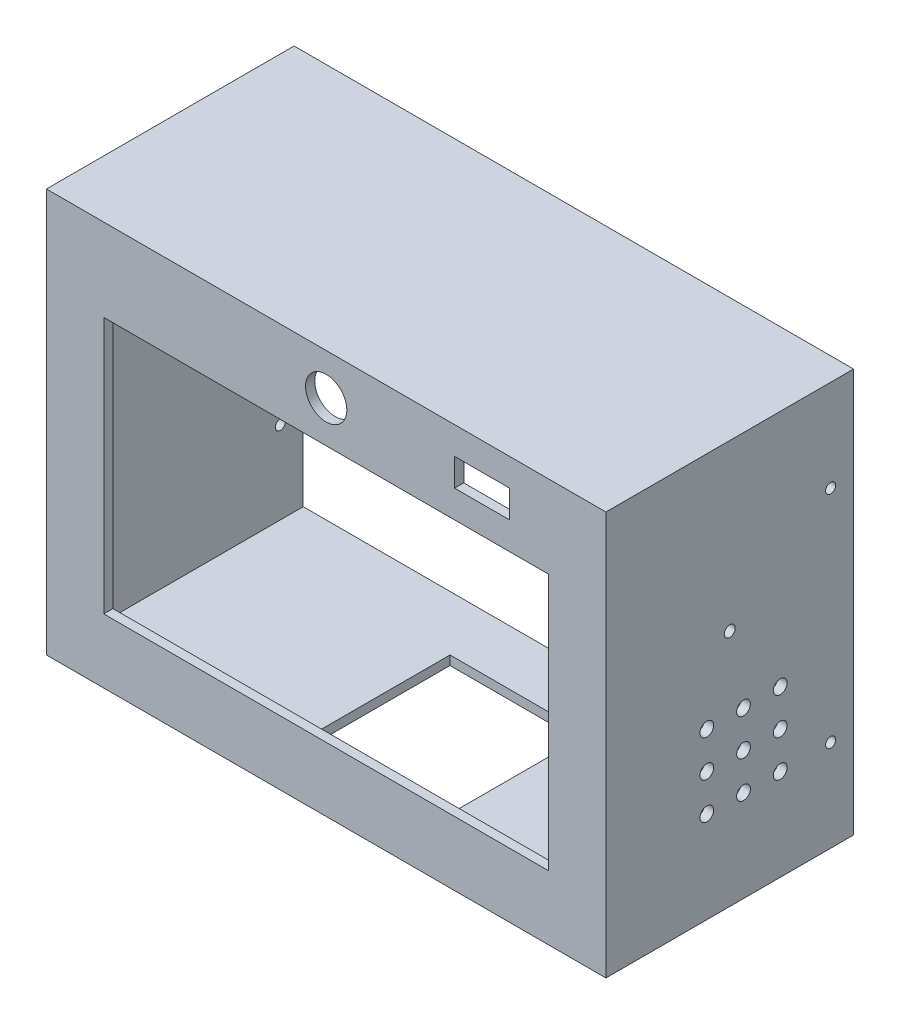
from build123d import *

# Parameters (mm, degrees)
SKETCH1_W            = 122
SKETCH1_H            = 88
BOSS_EXTRUDE1_DEPTH  = 54
BOSS_EXTRUDE2_START  = -1
SKETCH2_W            = 118
SKETCH2_H            = 84
BOSS_EXTRUDE2_DEPTH  = 53
BOSS_EXTRUDE3_START  = 50
SKETCH3_W            = 97
SKETCH3_H            = 56
BOSS_EXTRUDE3_DEPTH  = 10
BOSS_EXTRUDE4_START  = 50
SKETCH4_R            = 4.5
BOSS_EXTRUDE4_DEPTH  = 10
BOSS_EXTRUDE5_START  = 50
SKETCH5_W            = 12
SKETCH5_H            = 6
BOSS_EXTRUDE5_DEPTH  = 10
BOSS_EXTRUDE6_START  = -65
SKETCH6_R            = 1.2
BOSS_EXTRUDE6_DEPTH  = 130
BOSS_EXTRUDE7_START  = 55
SKETCH7_R            = 1.5
BOSS_EXTRUDE7_DEPTH  = 10
BOSS_EXTRUDE8_START  = 55
SKETCH8_R            = 1.5
BOSS_EXTRUDE8_DEPTH  = 10
BOSS_EXTRUDE9_START  = 55
SKETCH9_R            = 1.5
BOSS_EXTRUDE9_DEPTH  = 10
BOSS_EXTRUDE10_START = 55
SKETCH10_R           = 1.5
BOSS_EXTRUDE10_DEPTH = 10
BOSS_EXTRUDE11_START = 55
SKETCH11_R           = 1.5
BOSS_EXTRUDE11_DEPTH = 10
BOSS_EXTRUDE12_START = 55
SKETCH12_R           = 1.5
BOSS_EXTRUDE12_DEPTH = 10
BOSS_EXTRUDE13_START = 55
SKETCH13_R           = 1.5
BOSS_EXTRUDE13_DEPTH = 10
BOSS_EXTRUDE14_START = 55
SKETCH14_R           = 1.5
BOSS_EXTRUDE14_DEPTH = 10
BOSS_EXTRUDE15_START = 55
SKETCH15_R           = 1.5
BOSS_EXTRUDE15_DEPTH = 10
BOSS_EXTRUDE16_START = 12
SKETCH16_W           = 30
SKETCH16_H           = 4
BOSS_EXTRUDE16_DEPTH = 30
BOSS_EXTRUDE17_START = -65
SKETCH17_R           = 1.1
BOSS_EXTRUDE17_DEPTH = 130
BOSS_EXTRUDE18_START = -65
SKETCH18_R           = 1.1
BOSS_EXTRUDE18_DEPTH = 130


with BuildPart() as part:
    # Sketch1 → Boss-Extrude1 (new body)
    with BuildSketch(Plane.XY):
        with Locations((0, 44)):
            Rectangle(SKETCH1_W, SKETCH1_H)
    extrude(amount=BOSS_EXTRUDE1_DEPTH)


with BuildPart() as body_2:
    # Sketch2 → Boss-Extrude2 (new body)
    with BuildSketch(Plane.XY.offset(BOSS_EXTRUDE2_START)):
        with Locations((0, 44)):
            Rectangle(SKETCH2_W, SKETCH2_H)
    extrude(amount=BOSS_EXTRUDE2_DEPTH)


with BuildPart() as part_1:
    add(part.part)

    # Combine1: cut body 2
    add(body_2.part, mode=Mode.SUBTRACT)


with BuildPart() as body_2_2:
    # Sketch3 → Boss-Extrude3 (new body)
    with BuildSketch(Plane.XY.offset(BOSS_EXTRUDE3_START)):
        with Locations((0, 42)):
            Rectangle(SKETCH3_W, SKETCH3_H)
    extrude(amount=BOSS_EXTRUDE3_DEPTH)


with BuildPart() as part_2:
    add(part_1.part)

    # Combine2: cut body 2 2
    add(body_2_2.part, mode=Mode.SUBTRACT)


with BuildPart() as body_2_3:
    # Sketch4 → Boss-Extrude4 (new body)
    with BuildSketch(Plane.XY.offset(BOSS_EXTRUDE4_START)):
        with Locations((0, 79)):
            Circle(SKETCH4_R)
    extrude(amount=BOSS_EXTRUDE4_DEPTH)


with BuildPart() as part_3:
    add(part_2.part)

    # Combine3: cut body 2 3
    add(body_2_3.part, mode=Mode.SUBTRACT)


with BuildPart() as body_2_4:
    # Sketch5 → Boss-Extrude5 (new body)
    with BuildSketch(Plane.XY.offset(BOSS_EXTRUDE5_START)):
        with Locations((34, 79)):
            Rectangle(SKETCH5_W, SKETCH5_H)
    extrude(amount=BOSS_EXTRUDE5_DEPTH)


with BuildPart() as part_4:
    add(part_3.part)

    # Combine4: cut body 2 4
    add(body_2_4.part, mode=Mode.SUBTRACT)


with BuildPart() as body_2_5:
    # Sketch6 → Boss-Extrude6 (new body)
    with BuildSketch(Plane(origin=(0, 0, 0), x_dir=(0, 0, -1), z_dir=(1, 0, 0)).offset(BOSS_EXTRUDE6_START)):
        with Locations((-27, 52)):
            Circle(SKETCH6_R)
    extrude(amount=BOSS_EXTRUDE6_DEPTH)


with BuildPart() as part_5:
    add(part_4.part)

    # Combine5: cut body 2 5
    add(body_2_5.part, mode=Mode.SUBTRACT)


with BuildPart() as body_2_6:
    # Sketch7 → Boss-Extrude7 (new body)
    with BuildSketch(Plane(origin=(0, 0, 0), x_dir=(0, 0, -1), z_dir=(1, 0, 0)).offset(BOSS_EXTRUDE7_START)):
        with Locations((-16, 20)):
            Circle(SKETCH7_R)
    extrude(amount=BOSS_EXTRUDE7_DEPTH)


with BuildPart() as part_6:
    add(part_5.part)

    # Combine6: cut body 2 6
    add(body_2_6.part, mode=Mode.SUBTRACT)


with BuildPart() as body_2_7:
    # Sketch8 → Boss-Extrude8 (new body)
    with BuildSketch(Plane(origin=(0, 0, 0), x_dir=(0, 0, -1), z_dir=(1, 0, 0)).offset(BOSS_EXTRUDE8_START)):
        with Locations((-24, 20)):
            Circle(SKETCH8_R)
    extrude(amount=BOSS_EXTRUDE8_DEPTH)


with BuildPart() as part_7:
    add(part_6.part)

    # Combine7: cut body 2 7
    add(body_2_7.part, mode=Mode.SUBTRACT)


with BuildPart() as body_2_8:
    # Sketch9 → Boss-Extrude9 (new body)
    with BuildSketch(Plane(origin=(0, 0, 0), x_dir=(0, 0, -1), z_dir=(1, 0, 0)).offset(BOSS_EXTRUDE9_START)):
        with Locations((-32, 20)):
            Circle(SKETCH9_R)
    extrude(amount=BOSS_EXTRUDE9_DEPTH)


with BuildPart() as part_8:
    add(part_7.part)

    # Combine8: cut body 2 8
    add(body_2_8.part, mode=Mode.SUBTRACT)


with BuildPart() as body_2_9:
    # Sketch10 → Boss-Extrude10 (new body)
    with BuildSketch(Plane(origin=(0, 0, 0), x_dir=(0, 0, -1), z_dir=(1, 0, 0)).offset(BOSS_EXTRUDE10_START)):
        with Locations((-16, 28)):
            Circle(SKETCH10_R)
    extrude(amount=BOSS_EXTRUDE10_DEPTH)


with BuildPart() as part_9:
    add(part_8.part)

    # Combine9: cut body 2 9
    add(body_2_9.part, mode=Mode.SUBTRACT)


with BuildPart() as body_2_10:
    # Sketch11 → Boss-Extrude11 (new body)
    with BuildSketch(Plane(origin=(0, 0, 0), x_dir=(0, 0, -1), z_dir=(1, 0, 0)).offset(BOSS_EXTRUDE11_START)):
        with Locations((-24, 28)):
            Circle(SKETCH11_R)
    extrude(amount=BOSS_EXTRUDE11_DEPTH)


with BuildPart() as part_10:
    add(part_9.part)

    # Combine10: cut body 2 10
    add(body_2_10.part, mode=Mode.SUBTRACT)


with BuildPart() as body_2_11:
    # Sketch12 → Boss-Extrude12 (new body)
    with BuildSketch(Plane(origin=(0, 0, 0), x_dir=(0, 0, -1), z_dir=(1, 0, 0)).offset(BOSS_EXTRUDE12_START)):
        with Locations((-32, 28)):
            Circle(SKETCH12_R)
    extrude(amount=BOSS_EXTRUDE12_DEPTH)


with BuildPart() as part_11:
    add(part_10.part)

    # Combine11: cut body 2 11
    add(body_2_11.part, mode=Mode.SUBTRACT)


with BuildPart() as body_2_12:
    # Sketch13 → Boss-Extrude13 (new body)
    with BuildSketch(Plane(origin=(0, 0, 0), x_dir=(0, 0, -1), z_dir=(1, 0, 0)).offset(BOSS_EXTRUDE13_START)):
        with Locations((-16, 36)):
            Circle(SKETCH13_R)
    extrude(amount=BOSS_EXTRUDE13_DEPTH)


with BuildPart() as part_12:
    add(part_11.part)

    # Combine12: cut body 2 12
    add(body_2_12.part, mode=Mode.SUBTRACT)


with BuildPart() as body_2_13:
    # Sketch14 → Boss-Extrude14 (new body)
    with BuildSketch(Plane(origin=(0, 0, 0), x_dir=(0, 0, -1), z_dir=(1, 0, 0)).offset(BOSS_EXTRUDE14_START)):
        with Locations((-24, 36)):
            Circle(SKETCH14_R)
    extrude(amount=BOSS_EXTRUDE14_DEPTH)


with BuildPart() as part_13:
    add(part_12.part)

    # Combine13: cut body 2 13
    add(body_2_13.part, mode=Mode.SUBTRACT)


with BuildPart() as body_2_14:
    # Sketch15 → Boss-Extrude15 (new body)
    with BuildSketch(Plane(origin=(0, 0, 0), x_dir=(0, 0, -1), z_dir=(1, 0, 0)).offset(BOSS_EXTRUDE15_START)):
        with Locations((-32, 36)):
            Circle(SKETCH15_R)
    extrude(amount=BOSS_EXTRUDE15_DEPTH)


with BuildPart() as part_14:
    add(part_13.part)

    # Combine14: cut body 2 14
    add(body_2_14.part, mode=Mode.SUBTRACT)


with BuildPart() as body_2_15:
    # Sketch16 → Boss-Extrude16 (new body)
    with BuildSketch(Plane.XY.offset(BOSS_EXTRUDE16_START)):
        with Locations((0, 1)):
            Rectangle(SKETCH16_W, SKETCH16_H)
    extrude(amount=BOSS_EXTRUDE16_DEPTH)


with BuildPart() as part_15:
    add(part_14.part)

    # Combine15: cut body 2 15
    add(body_2_15.part, mode=Mode.SUBTRACT)


with BuildPart() as body_2_16:
    # Sketch17 → Boss-Extrude17 (new body)
    with BuildSketch(Plane(origin=(0, 0, 0), x_dir=(0, 0, -1), z_dir=(1, 0, 0)).offset(BOSS_EXTRUDE17_START)):
        with Locations((-5, 20)):
            Circle(SKETCH17_R)
    extrude(amount=BOSS_EXTRUDE17_DEPTH)


with BuildPart() as part_16:
    add(part_15.part)

    # Combine16: cut body 2 16
    add(body_2_16.part, mode=Mode.SUBTRACT)


with BuildPart() as body_2_17:
    # Sketch18 → Boss-Extrude18 (new body)
    with BuildSketch(Plane(origin=(0, 0, 0), x_dir=(0, 0, -1), z_dir=(1, 0, 0)).offset(BOSS_EXTRUDE18_START)):
        with Locations((-5, 68)):
            Circle(SKETCH18_R)
    extrude(amount=BOSS_EXTRUDE18_DEPTH)


with BuildPart() as part_17:
    add(part_16.part)

    # Combine17: cut body 2 17
    add(body_2_17.part, mode=Mode.SUBTRACT)


solid = part_17.part
